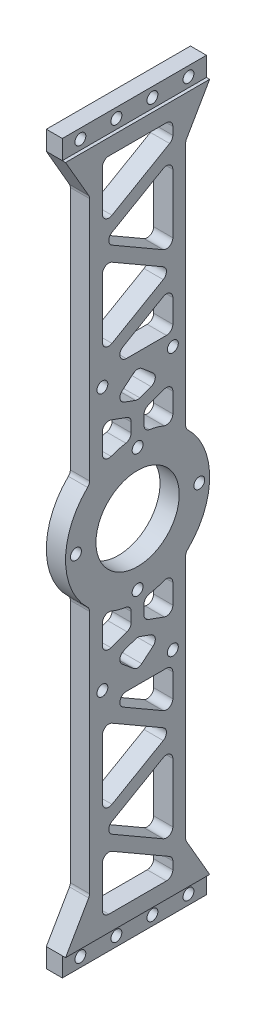
from build123d import *

# Parameters (mm, degrees)
SKETCH_1_W          = 6
SKETCH_1_H          = 30
EXTRUDE_1_DEPTH     = 227
SKETCH_2_R          = 22.5
EXTRUDE_2_DEPTH     = 6
SKETCH_3_R          = 13
CUT_EXTRUDE_1_DEPTH = 231.154839184
HOLE_WIZARD_M32_D   = 3.4
HOLE_WIZARD_M33_D   = 3.4
EXTRUDE_3_DEPTH     = 6
HOLE_WIZARD_M31_D   = 3.4
SKETCH_14_W         = 45
SKETCH_14_H         = 6
CUT_EXTRUDE_2_DEPTH = 1
CUT_EXTRUDE_3_REACH = 232.155
FILLET_1_R          = 2


with BuildPart() as part:
    # Эскиз1 → Бобышка-Вытянуть1 (new body)
    with BuildSketch(Plane(origin=(0, 0, 0), x_dir=(1, 0, 0), z_dir=(0, 1, 0))):
        with Locations((3, -15)):
            Rectangle(SKETCH_1_W, SKETCH_1_H)
    extrude(amount=EXTRUDE_1_DEPTH)

    # Эскиз2 → Бобышка-Вытянуть2 (add)
    with BuildSketch(Plane.ZY):
        with Locations((15, 113.5)):
            Circle(SKETCH_2_R)
    extrude(amount=-EXTRUDE_2_DEPTH)

    # Эскиз3 → Вырез-Вытянуть1 (cut, through all)
    with BuildSketch(Plane.ZY):
        with Locations((15, 113.5)):
            Circle(SKETCH_3_R)
    extrude(amount=-CUT_EXTRUDE_1_DEPTH, mode=Mode.SUBTRACT)

    # Отверстие с зазором M32 (through all)
    with Locations(Plane(origin=(6, -25.024735225, 7.262908886), x_dir=(0, 0, 1), z_dir=(1, 0, 0))):
        with Locations((7.737091114, -157.774735225), (-11.512908886, -138.524735225), (7.737091114, -119.274735225), (26.987091114, -138.524735225)):
            Hole(HOLE_WIZARD_M32_D / 2)

    # Отверстие с зазором M33 (through all)
    with Locations(Plane(origin=(6, 0, 0), x_dir=(0, 0, -1), z_dir=(1, 0, 0))):
        with Locations((-26, 154.5), (-4, 154.5), (-4, 72.5), (-26, 72.5)):
            Hole(HOLE_WIZARD_M33_D / 2)

    # Эскиз11 → Бобышка-Вытянуть3 (add)
    with BuildSketch(Plane(origin=(6, 0, 0), x_dir=(0, 0, -1), z_dir=(1, 0, 0))):
        Polygon((-37.5, 221), (-30, 208.009618943), (0, 208.009618943), (7.5, 221), (7.5, 227), (-37.5, 227), align=None)
        Polygon((0, 18.990381057), (7.5, 6), (7.5, 0), (-37.5, 0), (-37.5, 6), (-30, 18.990381057), align=None)
    extrude(amount=-EXTRUDE_3_DEPTH)

    # Отверстие с зазором M31 (through all)
    with Locations(Plane(origin=(6, 0, 0), x_dir=(0, 0, -1), z_dir=(1, 0, 0))):
        with Locations((-31.875, 224), (-20.625, 224), (-9.375, 224), (1.875, 224), (-31.875, 3), (-20.625, 3), (-9.375, 3), (1.875, 3)):
            Hole(HOLE_WIZARD_M31_D / 2)

    # Эскиз14 → Вырез-Вытянуть2 (cut)
    with BuildSketch(Plane(origin=(6, 0, 0), x_dir=(0, 0, -1), z_dir=(1, 0, 0))):
        with Locations((-15, 224)):
            Rectangle(SKETCH_14_W, SKETCH_14_H)
        with Locations((-15, 3)):
            Rectangle(SKETCH_14_W, SKETCH_14_H)
    extrude(amount=-CUT_EXTRUDE_2_DEPTH, mode=Mode.SUBTRACT)

    # Эскиз15 → Вырез-Вытянуть3 (cut, up to next)
    with BuildSketch(Plane.ZY, mode=Mode.PRIVATE) as cut_extrude_3_sk1:
        with BuildLine():
            Line((13, 91.089065169), (13, 85.005828051))
            Line((13, 85.005828051), (4, 81.730095943))
            Line((4, 81.730095943), (4, 93.872213574))
            ThreePointArc((4, 93.872213574), (8.352708916, 92.004337153), (13, 91.089065169))
        make_face()
    cut_extrude_3_tool1 = extrude(cut_extrude_3_sk1.sketch, amount=-CUT_EXTRUDE_3_REACH, mode=Mode.PRIVATE) & part.part
    # Эскиз15 → Вырез-Вытянуть3 (cut, up to next)
    with BuildSketch(Plane.ZY, mode=Mode.PRIVATE) as cut_extrude_3_sk2:
        with BuildLine():
            Line((17, 91.089065169), (17, 85.005828051))
            Line((17, 85.005828051), (26, 81.730095943))
            Line((26, 81.730095943), (26, 93.872213574))
            ThreePointArc((26, 93.872213574), (21.647291084, 92.004337153), (17, 91.089065169))
        make_face()
    cut_extrude_3_tool2 = extrude(cut_extrude_3_sk2.sketch, amount=-CUT_EXTRUDE_3_REACH, mode=Mode.PRIVATE) & part.part
    # Эскиз15 → Вырез-Вытянуть3 (cut, up to next)
    with BuildSketch(Plane.ZY, mode=Mode.PRIVATE) as cut_extrude_3_sk3:
        Polygon((7.538207724, 78.761187147), (15, 81.47705743), (22.461792276, 78.761187147), (15, 72.5), align=None)
    cut_extrude_3_tool3 = extrude(cut_extrude_3_sk3.sketch, amount=-CUT_EXTRUDE_3_REACH, mode=Mode.PRIVATE) & part.part
    # Эскиз15 → Вырез-Вытянуть3 (cut, up to next)
    with BuildSketch(Plane.ZY, mode=Mode.PRIVATE) as cut_extrude_3_sk4:
        Polygon((4, 68.5), (26, 68.5), (4, 55.798294078), align=None)
    cut_extrude_3_tool4 = extrude(cut_extrude_3_sk4.sketch, amount=-CUT_EXTRUDE_3_REACH, mode=Mode.PRIVATE) & part.part
    # Эскиз15 → Вырез-Вытянуть3 (cut, up to next)
    with BuildSketch(Plane.ZY, mode=Mode.PRIVATE) as cut_extrude_3_sk5:
        Polygon((4, 51.179491924), (26, 63.881197846), (26, 38.477786002), align=None)
    cut_extrude_3_tool5 = extrude(cut_extrude_3_sk5.sketch, amount=-CUT_EXTRUDE_3_REACH, mode=Mode.PRIVATE) & part.part
    # Эскиз15 → Вырез-Вытянуть3 (cut, up to next)
    with BuildSketch(Plane.ZY, mode=Mode.PRIVATE) as cut_extrude_3_sk6:
        Polygon((4, 46.560689771), (26, 33.858983849), (4, 21.157277926), align=None)
    cut_extrude_3_tool6 = extrude(cut_extrude_3_sk6.sketch, amount=-CUT_EXTRUDE_3_REACH, mode=Mode.PRIVATE) & part.part
    # Эскиз15 → Вырез-Вытянуть3 (cut, up to next)
    with BuildSketch(Plane.ZY, mode=Mode.PRIVATE) as cut_extrude_3_sk7:
        Polygon((4, 11), (4, 16.538475773), (26, 29.240181695), (26, 11), align=None)
    cut_extrude_3_tool7 = extrude(cut_extrude_3_sk7.sketch, amount=-CUT_EXTRUDE_3_REACH, mode=Mode.PRIVATE) & part.part
    # Эскиз15 → Вырез-Вытянуть3 (cut, up to next)
    with BuildSketch(Plane.ZY, mode=Mode.PRIVATE) as cut_extrude_3_sk8:
        Polygon((4, 171.201705922), (4, 158.5), (26, 158.5), align=None)
    cut_extrude_3_tool8 = extrude(cut_extrude_3_sk8.sketch, amount=-CUT_EXTRUDE_3_REACH, mode=Mode.PRIVATE) & part.part
    # Эскиз15 → Вырез-Вытянуть3 (cut, up to next)
    with BuildSketch(Plane.ZY, mode=Mode.PRIVATE) as cut_extrude_3_sk9:
        with BuildLine():
            Line((26, 145.269904057), (26, 133.127786426))
            ThreePointArc((26, 133.127786426), (21.647291084, 134.995662847), (17, 135.910934831))
            Line((17, 135.910934831), (17, 141.994171949))
            Line((17, 141.994171949), (26, 145.269904057))
        make_face()
    cut_extrude_3_tool9 = extrude(cut_extrude_3_sk9.sketch, amount=-CUT_EXTRUDE_3_REACH, mode=Mode.PRIVATE) & part.part
    # Эскиз15 → Вырез-Вытянуть3 (cut, up to next)
    with BuildSketch(Plane.ZY, mode=Mode.PRIVATE) as cut_extrude_3_sk10:
        with BuildLine():
            Line((4, 145.269904057), (4, 133.127786426))
            ThreePointArc((4, 133.127786426), (8.352708916, 134.995662847), (13, 135.910934831))
            Line((13, 135.910934831), (13, 141.994171949))
            Line((13, 141.994171949), (4, 145.269904057))
        make_face()
    cut_extrude_3_tool10 = extrude(cut_extrude_3_sk10.sketch, amount=-CUT_EXTRUDE_3_REACH, mode=Mode.PRIVATE) & part.part
    # Эскиз15 → Вырез-Вытянуть3 (cut, up to next)
    with BuildSketch(Plane.ZY, mode=Mode.PRIVATE) as cut_extrude_3_sk11:
        Polygon((15, 145.52294257), (22.461792276, 148.238812853), (15, 154.5), (7.538207724, 148.238812853), align=None)
    cut_extrude_3_tool11 = extrude(cut_extrude_3_sk11.sketch, amount=-CUT_EXTRUDE_3_REACH, mode=Mode.PRIVATE) & part.part
    # Эскиз15 → Вырез-Вытянуть3 (cut, up to next)
    with BuildSketch(Plane.ZY, mode=Mode.PRIVATE) as cut_extrude_3_sk12:
        Polygon((4, 175.820508076), (26, 163.118802154), (26, 188.522213998), align=None)
    cut_extrude_3_tool12 = extrude(cut_extrude_3_sk12.sketch, amount=-CUT_EXTRUDE_3_REACH, mode=Mode.PRIVATE) & part.part
    # Эскиз15 → Вырез-Вытянуть3 (cut, up to next)
    with BuildSketch(Plane.ZY, mode=Mode.PRIVATE) as cut_extrude_3_sk13:
        Polygon((4, 180.439310229), (26, 193.141016151), (4, 205.842722074), align=None)
    cut_extrude_3_tool13 = extrude(cut_extrude_3_sk13.sketch, amount=-CUT_EXTRUDE_3_REACH, mode=Mode.PRIVATE) & part.part
    # Эскиз15 → Вырез-Вытянуть3 (cut, up to next)
    with BuildSketch(Plane.ZY, mode=Mode.PRIVATE) as cut_extrude_3_sk14:
        Polygon((4, 216), (4, 210.461524227), (26, 197.759818305), (26, 216), align=None)
    cut_extrude_3_tool14 = extrude(cut_extrude_3_sk14.sketch, amount=-CUT_EXTRUDE_3_REACH, mode=Mode.PRIVATE) & part.part
    add(cut_extrude_3_tool1.solids().sort_by_distance((0, 87.736423, 7.983843))[0], mode=Mode.SUBTRACT)
    add(cut_extrude_3_tool2.solids().sort_by_distance((0, 87.736423, 22.016157))[0], mode=Mode.SUBTRACT)
    add(cut_extrude_3_tool3.solids().sort_by_distance((0, 77.579415, 15))[0], mode=Mode.SUBTRACT)
    add(cut_extrude_3_tool4.solids().sort_by_distance((0, 64.266098, 11.333333))[0], mode=Mode.SUBTRACT)
    add(cut_extrude_3_tool5.solids().sort_by_distance((0, 51.179492, 18.666667))[0], mode=Mode.SUBTRACT)
    add(cut_extrude_3_tool6.solids().sort_by_distance((0, 33.858984, 11.333333))[0], mode=Mode.SUBTRACT)
    add(cut_extrude_3_tool7.solids().sort_by_distance((0, 17.510064, 16.958602))[0], mode=Mode.SUBTRACT)
    add(cut_extrude_3_tool8.solids().sort_by_distance((0, 162.733902, 11.333333))[0], mode=Mode.SUBTRACT)
    add(cut_extrude_3_tool9.solids().sort_by_distance((0, 139.263577, 22.016157))[0], mode=Mode.SUBTRACT)
    add(cut_extrude_3_tool10.solids().sort_by_distance((0, 139.263577, 7.983843))[0], mode=Mode.SUBTRACT)
    add(cut_extrude_3_tool11.solids().sort_by_distance((0, 149.420585, 15))[0], mode=Mode.SUBTRACT)
    add(cut_extrude_3_tool12.solids().sort_by_distance((0, 175.820508, 18.666667))[0], mode=Mode.SUBTRACT)
    add(cut_extrude_3_tool13.solids().sort_by_distance((0, 193.141016, 11.333333))[0], mode=Mode.SUBTRACT)
    add(cut_extrude_3_tool14.solids().sort_by_distance((0, 209.489936, 16.958602))[0], mode=Mode.SUBTRACT)

    # Скругление1
    fillet_1_edges = [part.edges().sort_by_distance(p)[0] for p in [
        (3, 18.990381057, 30),
        (3, 18.990381057, 0),
        (3, 96.729490169, 0),
        (3, 130.270509831, 0),
        (3, 96.729490169, 30),
        (3, 130.270509831, 30),
        (3, 93.872213574, 4),
        (3, 91.089065169, 13),
        (3, 85.005828051, 13),
        (3, 81.730095943, 4),
        (3, 91.089065169, 17),
        (3, 93.872213574, 26),
        (3, 81.730095943, 26),
        (3, 85.005828051, 17),
        (3, 72.5, 15),
        (3, 78.761187147, 7.538207724),
        (3, 81.47705743, 15),
        (3, 78.761187147, 22.461792276),
        (3, 55.798294078, 4),
        (3, 68.5, 4),
        (3, 68.5, 26),
        (3, 38.477786002, 26),
        (3, 51.179491924, 4),
        (3, 63.881197846, 26),
        (3, 21.157277926, 4),
        (3, 46.560689771, 4),
        (3, 33.858983849, 26),
        (3, 11, 26),
        (3, 11, 4),
        (3, 16.538475773, 4),
        (3, 29.240181695, 26),
        (3, 171.201705922, 4),
        (3, 158.5, 26),
        (3, 158.5, 4),
        (3, 141.994171949, 17),
        (3, 145.269904057, 26),
        (3, 133.127786426, 26),
        (3, 135.910934831, 17),
        (3, 135.910934831, 13),
        (3, 133.127786426, 4),
        (3, 145.269904057, 4),
        (3, 141.994171949, 13),
        (3, 145.52294257, 15),
        (3, 148.238812853, 7.538207724),
        (3, 154.5, 15),
        (3, 148.238812853, 22.461792276),
        (3, 175.820508076, 4),
        (3, 188.522213998, 26),
        (3, 163.118802154, 26),
        (3, 180.439310229, 4),
        (3, 205.842722074, 4),
        (3, 193.141016151, 26),
        (3, 216, 4),
        (3, 216, 26),
        (3, 197.759818305, 26),
        (3, 210.461524227, 4),
        (3, 208.009618943, 0),
        (3, 208.009618943, 30),
    ]]
    fillet(fillet_1_edges, radius=FILLET_1_R)


solid = part.part
